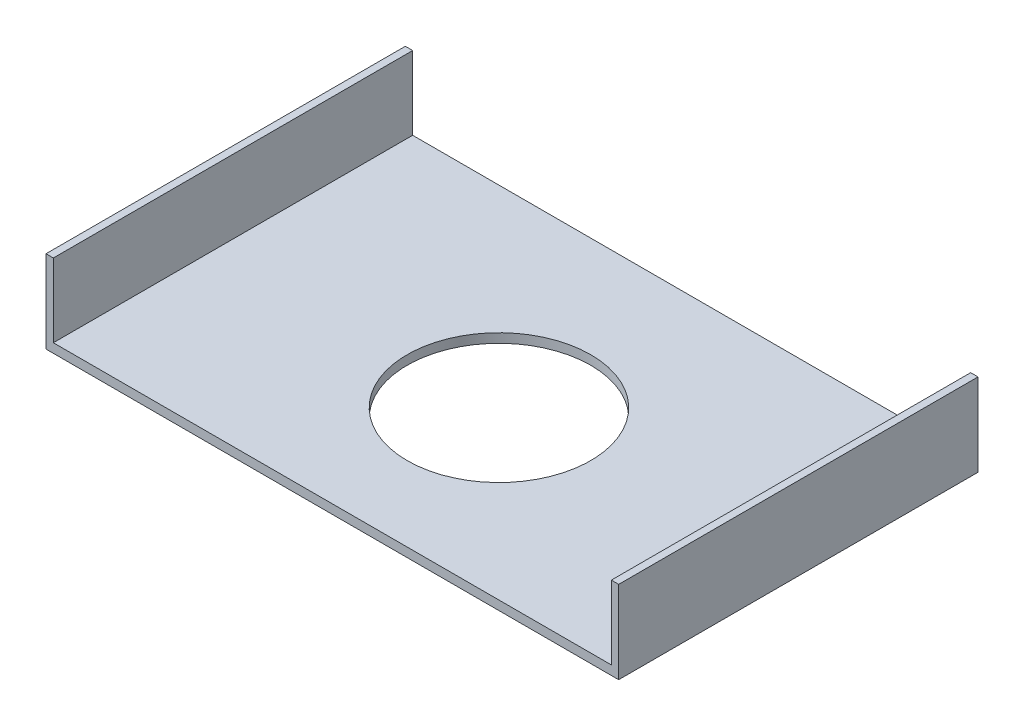
from build123d import *

# Parameters (mm, degrees)
SKETCH1_W               = 312
SKETCH1_H               = 230
BOSS_EXTRUDE1_DEPTH     = 5
SKETCH2_W               = 4
SKETCH2_H               = 230
BOSS_EXTRUDE2_DEPTH     = 40
SKETCH3_R               = 50
CUT_EXTRUDE1_DEPTH      = 198.89138435
CUT_EXTRUDE2_DEPTH      = 198.89138435
CUT_EXTRUDE2_DEPTH_BACK = 198.89138435
SKETCH4_W               = 312
SKETCH4_H               = 10
SKETCH5_W               = 24.234530733
SKETCH5_H               = 45
CUT_EXTRUDE3_DEPTH      = 336.550294293


with BuildPart() as part:
    # Sketch1 → Boss-Extrude1 (new body)
    with BuildSketch(Plane(origin=(0, 0, 0), x_dir=(1, 0, 0), z_dir=(0, 1, 0))):
        Rectangle(SKETCH1_W, SKETCH1_H)
    extrude(amount=BOSS_EXTRUDE1_DEPTH)

    # Sketch2 → Boss-Extrude2 (add)
    with BuildSketch(Plane(origin=(0, 5, 0), x_dir=(1, 0, 0), z_dir=(0, 1, 0))):
        with Locations((-154, 0)):
            Rectangle(SKETCH2_W, SKETCH2_H)
        with Locations((154, 0)):
            Rectangle(SKETCH2_W, SKETCH2_H)
    extrude(amount=BOSS_EXTRUDE2_DEPTH)

    # Sketch3 → Cut-Extrude1 (cut, through all)
    with BuildSketch(Plane(origin=(0, 5, 0), x_dir=(1, 0, 0), z_dir=(0, 1, 0))):
        with Locations(Location((0, 0, 0), (0, 0, 270))):
            Circle(SKETCH3_R)
    extrude(amount=-CUT_EXTRUDE1_DEPTH, mode=Mode.SUBTRACT)

    # Sketch4 → Cut-Extrude2 (cut, two sides: drawn at the far end of the back side and taken through both)
    with BuildSketch(Plane(origin=(0, 5, 0), x_dir=(1, 0, 0), z_dir=(0, 1, 0)).offset(-CUT_EXTRUDE2_DEPTH_BACK)):
        with Locations((0, 110)):
            Rectangle(SKETCH4_W, SKETCH4_H)
    extrude(amount=CUT_EXTRUDE2_DEPTH + CUT_EXTRUDE2_DEPTH_BACK, mode=Mode.SUBTRACT)

    # Sketch5 → Cut-Extrude3 (cut, through all)
    with BuildSketch(Plane(origin=(156, 0, 0), x_dir=(0, 0, -1), z_dir=(1, 0, 0))):
        with Locations((-102.882734634, 22.5)):
            Rectangle(SKETCH5_W, SKETCH5_H)
    extrude(amount=-CUT_EXTRUDE3_DEPTH, mode=Mode.SUBTRACT)


solid = part.part
